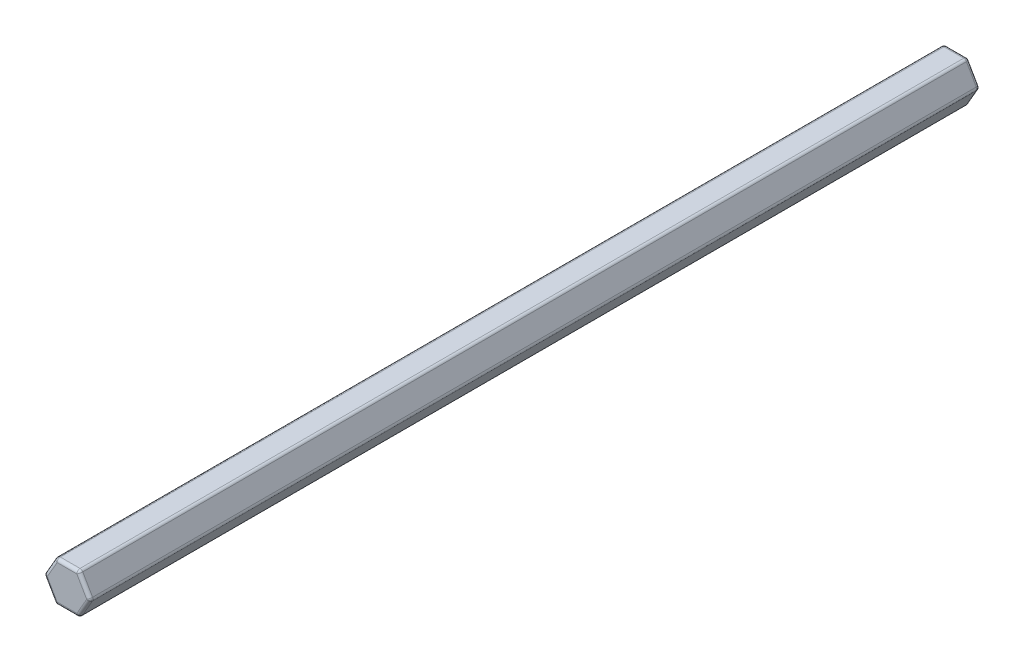
from build123d import *

# Parameters (mm, degrees)
BOSS_EXTRUDE1_DEPTH = 139.7
FILLET1_R           = 1


with BuildPart() as part:
    # Sketch1 → Boss-Extrude1 (new, symmetric)
    with BuildSketch(Plane.XY):
        Polygon((7.332348419, 0), (3.666174209, 6.35), (-3.666174209, 6.35), (-7.332348419, 0), (-3.666174209, -6.35), (3.666174209, -6.35), align=None)
    extrude(amount=BOSS_EXTRUDE1_DEPTH, both=True)

    # Fillet1
    fillet1_edges = [part.edges().sort_by_distance(p)[0] for p in [
        (3.666174209, -6.35, 0),
        (-3.666174209, -6.35, 0),
        (-7.332348419, 0, 0),
        (-3.666174209, 6.35, 0),
        (3.666174209, 6.35, 0),
        (7.332348419, 0, 0),
        (0, 6.35, 139.7),
        (-5.499261314, 3.175, 139.7),
        (-5.499261314, -3.175, 139.7),
        (0, -6.35, 139.7),
        (5.499261314, -3.175, 139.7),
        (0, -6.35, -139.7),
        (-5.499261314, -3.175, -139.7),
        (-5.499261314, 3.175, -139.7),
        (0, 6.35, -139.7),
        (5.499261314, 3.175, -139.7),
        (5.499261314, -3.175, -139.7),
        (5.499261314, 3.175, 139.7),
    ]]
    fillet(fillet1_edges, radius=FILLET1_R)


solid = part.part
